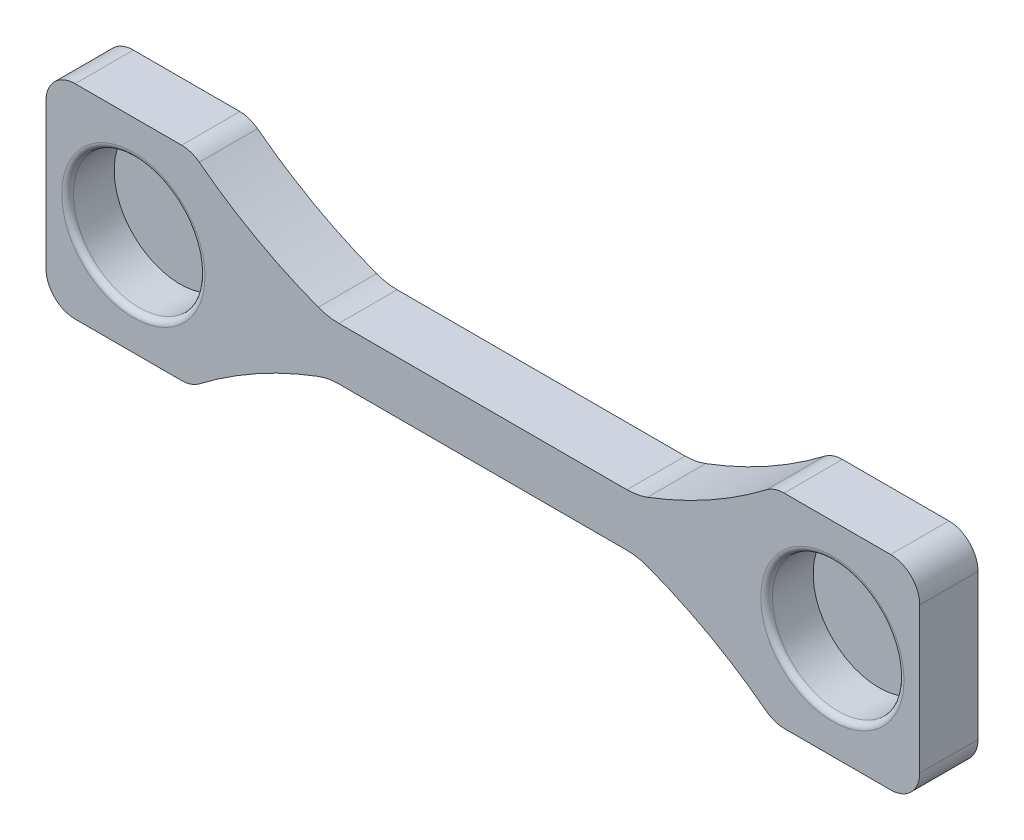
from build123d import *

# Parameters (mm, degrees)
SKETCH1_W           = 150
SKETCH1_H           = 35
BOSS_EXTRUDE1_DEPTH = 10
SKETCH2_R           = 11.3
CUT_EXTRUDE1_DEPTH  = 8
CUT_EXTRUDE2_DEPTH  = 78.661122835
FILLET1_R           = 5
FILLET2_R           = 1


with BuildPart() as part:
    # Sketch1 → Boss-Extrude1 (new body)
    with BuildSketch(Plane.XY):
        Rectangle(SKETCH1_W, SKETCH1_H)
    extrude(amount=BOSS_EXTRUDE1_DEPTH)

    # Sketch2 → Cut-Extrude1 (cut)
    with BuildSketch(Plane.XY.offset(10)):
        with Locations((-60, 0)):
            Circle(SKETCH2_R)
        with Locations((60, 0)):
            Circle(SKETCH2_R)
    extrude(amount=-CUT_EXTRUDE1_DEPTH, mode=Mode.SUBTRACT)

    # Sketch3 → Cut-Extrude2 (cut, through all)
    with BuildSketch(Plane.XY.offset(10)):
        with BuildLine():
            Line((24.729241078, -4.501356784), (-24.729241078, -4.501356784))
            ThreePointArc((-24.729241078, -4.501356784), (-26.520071482, -4.663017165), (-28.253000621, -5.142771491))
            ThreePointArc((-28.253000621, -5.142771491), (-39.611340556, -10.468134508), (-50, -17.5))
            Line((-50, -17.5), (50, -17.5))
            ThreePointArc((50, -17.5), (39.611340556, -10.468134508), (28.253000621, -5.142771491))
            ThreePointArc((28.253000621, -5.142771491), (26.520071482, -4.663017165), (24.729241078, -4.501356784))
        make_face()
        with BuildLine():
            ThreePointArc((-28.253000621, 5.142771491), (-26.520071482, 4.663017165), (-24.729241078, 4.501356784))
            Line((-24.729241078, 4.501356784), (24.729241078, 4.501356784))
            ThreePointArc((24.729241078, 4.501356784), (26.520071482, 4.663017165), (28.253000621, 5.142771491))
            ThreePointArc((28.253000621, 5.142771491), (39.611340556, 10.468134508), (50, 17.5))
            Line((50, 17.5), (-50, 17.5))
            ThreePointArc((-50, 17.5), (-39.611340556, 10.468134508), (-28.253000621, 5.142771491))
        make_face()
    extrude(amount=-CUT_EXTRUDE2_DEPTH, mode=Mode.SUBTRACT)

    # Fillet1
    fillet1_edges = [part.edges().sort_by_distance(p)[0] for p in [
        (50, -17.5, 5),
        (-50, -17.5, 5),
        (-50, 17.5, 5),
        (50, 17.5, 5),
        (-75, 17.5, 5),
        (75, 17.5, 5),
        (75, -17.5, 5),
        (-75, -17.5, 5),
    ]]
    fillet(fillet1_edges, radius=FILLET1_R)

    # Fillet2
    fillet2_edges = [part.edges().sort_by_distance(p)[0] for p in [
        (-71.3, 0, 10),
        (48.7, 0, 10),
    ]]
    fillet(fillet2_edges, radius=FILLET2_R)


solid = part.part
